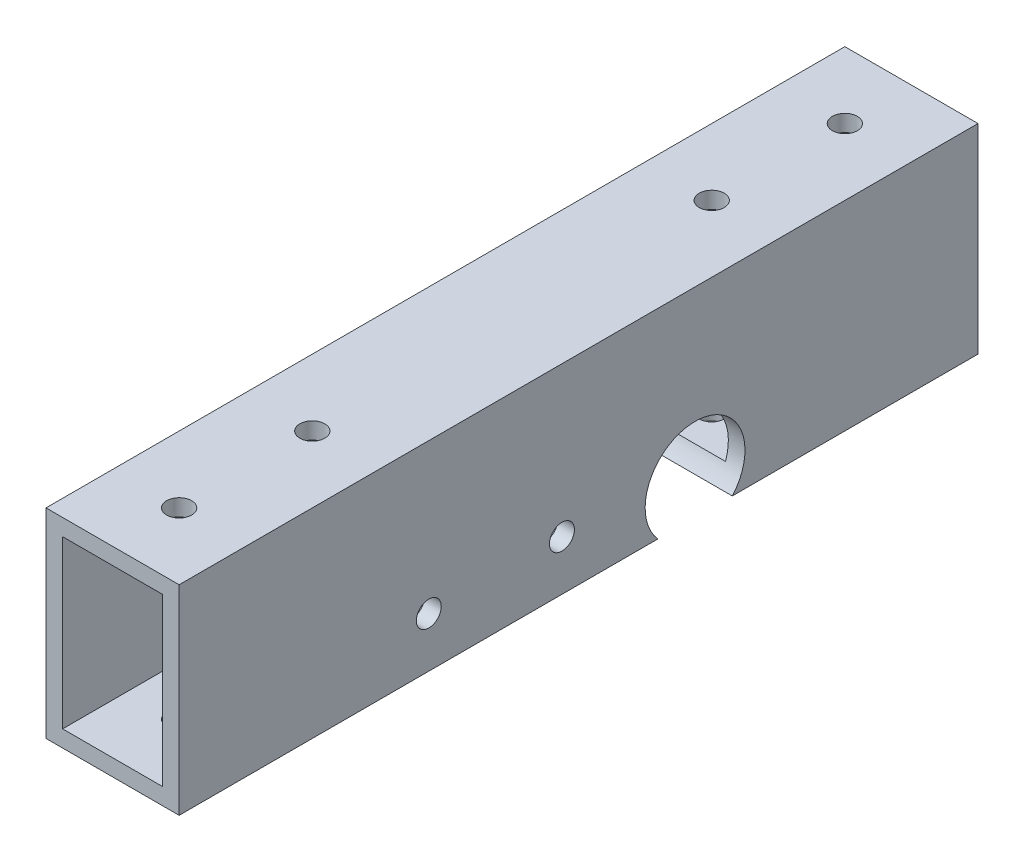
from build123d import *

# Parameters (mm, degrees)
SKETCH1_W           = 25.4
SKETCH1_H           = 38.1
BOSS_EXTRUDE1_DEPTH = 152.4
SHELL1_T            = -3.175
SKETCH2_R           = 9.525
CUT_EXTRUDE1_DEPTH  = 156.672163536
SKETCH3_R           = 2.38125
CUT_EXTRUDE2_DEPTH  = 158.602855304
SKETCH4_R           = 2.38125
CUT_EXTRUDE3_DEPTH  = 156.672163536
SKETCH5_R           = 2.38125
CUT_EXTRUDE4_DEPTH  = 158.602855304


with BuildPart() as part:
    # Sketch1 → Boss-Extrude1 (new body)
    with BuildSketch(Plane.XY):
        Rectangle(SKETCH1_W, SKETCH1_H)
    extrude(amount=BOSS_EXTRUDE1_DEPTH)

    # Shell1
    shell1_openings = [part.faces().sort_by_distance(p)[0] for p in [
        (0, 0, 152.4),
        (0, 0, 0),
    ]]
    offset(amount=SHELL1_T, openings=shell1_openings, kind=Kind.INTERSECTION)

    # Sketch2 → Cut-Extrude1 (cut, through all)
    with BuildSketch(Plane(origin=(12.7, 0, 0), x_dir=(0, 0, -1), z_dir=(1, 0, 0))):
        with Locations((-53.975, -12.7)):
            Circle(SKETCH2_R)
    extrude(amount=-CUT_EXTRUDE1_DEPTH, mode=Mode.SUBTRACT)

    # Sketch3 → Cut-Extrude2 (cut, through all)
    with BuildSketch(Plane(origin=(0, 19.05, 0), x_dir=(1, 0, 0), z_dir=(0, 1, 0))):
        with Locations(Location((0, -139.7, 0), (0, 0, 270))):
            Circle(SKETCH3_R)
        with Locations(Location((0, -114.3, 0), (0, 0, 270))):
            Circle(SKETCH3_R)
    extrude(amount=-CUT_EXTRUDE2_DEPTH, mode=Mode.SUBTRACT)

    # Sketch4 → Cut-Extrude3 (cut, through all)
    with BuildSketch(Plane(origin=(12.7, 0, 0), x_dir=(0, 0, -1), z_dir=(1, 0, 0))):
        with Locations(Location((-79.375, -9.525, 0), (0, 0, 90))):
            Circle(SKETCH4_R)
        with Locations(Location((-104.775, -9.525, 0), (0, 0, 90))):
            Circle(SKETCH4_R)
    extrude(amount=-CUT_EXTRUDE3_DEPTH, mode=Mode.SUBTRACT)

    # Sketch5 → Cut-Extrude4 (cut, through all)
    with BuildSketch(Plane(origin=(0, 19.05, 0), x_dir=(1, 0, 0), z_dir=(0, 1, 0))):
        with Locations(Location((0, -12.7, 0), (0, 0, 270))):
            Circle(SKETCH5_R)
        with Locations(Location((0, -38.1, 0), (0, 0, 270))):
            Circle(SKETCH5_R)
    extrude(amount=-CUT_EXTRUDE4_DEPTH, mode=Mode.SUBTRACT)


solid = part.part
